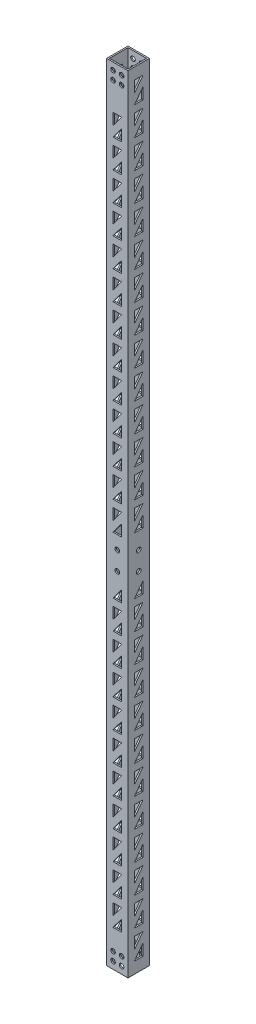
from build123d import *

# Parameters (mm, degrees)
SKETCH_1_W          = 15
SKETCH_1_H          = 15
SKETCH_1_W_2        = 13
SKETCH_1_H_2        = 13
EXTRUDE_1_DEPTH     = 551
SKETCH_2_R          = 1.6
CUT_EXTRUDE_1_DEPTH = 15
SKETCH_4_R          = 1.6
CUT_EXTRUDE_2_DEPTH = 15


with BuildPart() as part:
    # 草图1 → 凸台-拉伸1 (new body)
    with BuildSketch(Plane(origin=(0, 0, 0), x_dir=(1, 0, 0), z_dir=(0, 1, 0))):
        Rectangle(SKETCH_1_W, SKETCH_1_H)
        Rectangle(SKETCH_1_W_2, SKETCH_1_H_2, mode=Mode.SUBTRACT)
    extrude(amount=EXTRUDE_1_DEPTH)

    # 草图2 → 切除-拉伸1 (cut)
    with BuildSketch(Plane.XY.offset(7.5)):
        with Locations((-3, 546)):
            Circle(SKETCH_2_R)
        with Locations((3, 546)):
            Circle(SKETCH_2_R)
        with Locations((-3, 540)):
            Circle(SKETCH_2_R)
        with Locations((3, 540)):
            Circle(SKETCH_2_R)
        with Locations((3, 11)):
            Circle(SKETCH_2_R)
        with Locations((-3, 11)):
            Circle(SKETCH_2_R)
        with Locations((3, 5)):
            Circle(SKETCH_2_R)
        with Locations((-3, 5)):
            Circle(SKETCH_2_R)
        with Locations((0, 256.2)):
            Circle(SKETCH_2_R)
        with Locations((0, 243.2)):
            Circle(SKETCH_2_R)
        Polygon((-3, 512.5), (-3, 520.5), (3, 520.5), align=None)
        Polygon((-3, 505.5), (3, 505.5), (3, 513.5), align=None)
        Polygon((3, 500.5), (-3, 492.5), (-3, 500.5), align=None)
        Polygon((3, 493.5), (-3, 485.5), (3, 485.5), align=None)
        Polygon((3, 480.5), (-3, 472.5), (-3, 480.5), align=None)
        Polygon((3, 473.5), (-3, 465.5), (3, 465.5), align=None)
        Polygon((3, 460.5), (-3, 452.5), (-3, 460.5), align=None)
        Polygon((3, 453.5), (-3, 445.5), (3, 445.5), align=None)
        Polygon((3, 440.5), (-3, 432.5), (-3, 440.5), align=None)
        Polygon((3, 433.5), (-3, 425.5), (3, 425.5), align=None)
        Polygon((3, 420.5), (-3, 412.5), (-3, 420.5), align=None)
        Polygon((3, 413.5), (-3, 405.5), (3, 405.5), align=None)
        Polygon((3, 400.5), (-3, 392.5), (-3, 400.5), align=None)
        Polygon((3, 393.5), (-3, 385.5), (3, 385.5), align=None)
        Polygon((3, 380.5), (-3, 372.5), (-3, 380.5), align=None)
        Polygon((3, 373.5), (-3, 365.5), (3, 365.5), align=None)
        Polygon((3, 360.5), (-3, 352.5), (-3, 360.5), align=None)
        Polygon((3, 353.5), (-3, 345.5), (3, 345.5), align=None)
        Polygon((3, 340.5), (-3, 332.5), (-3, 340.5), align=None)
        Polygon((3, 333.5), (-3, 325.5), (3, 325.5), align=None)
        Polygon((3, 320.5), (-3, 312.5), (-3, 320.5), align=None)
        Polygon((3, 313.5), (-3, 305.5), (3, 305.5), align=None)
        Polygon((3, 300.5), (-3, 292.5), (-3, 300.5), align=None)
        Polygon((3, 293.5), (-3, 285.5), (3, 285.5), align=None)
        Polygon((3, 280.5), (-3, 272.5), (-3, 280.5), align=None)
        Polygon((3, 273.5), (-3, 265.5), (3, 265.5), align=None)
        Polygon((3, 233.5), (-3, 225.5), (3, 225.5), align=None)
        Polygon((3, 220.5), (-3, 212.5), (-3, 220.5), align=None)
        Polygon((3, 213.5), (-3, 205.5), (3, 205.5), align=None)
        Polygon((3, 200.5), (-3, 192.5), (-3, 200.5), align=None)
        Polygon((3, 193.5), (-3, 185.5), (3, 185.5), align=None)
        Polygon((3, 180.5), (-3, 172.5), (-3, 180.5), align=None)
        Polygon((3, 173.5), (-3, 165.5), (3, 165.5), align=None)
        Polygon((3, 160.5), (-3, 152.5), (-3, 160.5), align=None)
        Polygon((3, 153.5), (-3, 145.5), (3, 145.5), align=None)
        Polygon((3, 140.5), (-3, 132.5), (-3, 140.5), align=None)
        Polygon((3, 133.5), (-3, 125.5), (3, 125.5), align=None)
        Polygon((3, 120.5), (-3, 112.5), (-3, 120.5), align=None)
        Polygon((3, 113.5), (-3, 105.5), (3, 105.5), align=None)
        Polygon((3, 100.5), (-3, 92.5), (-3, 100.5), align=None)
        Polygon((3, 93.5), (-3, 85.5), (3, 85.5), align=None)
        Polygon((3, 80.5), (-3, 72.5), (-3, 80.5), align=None)
        Polygon((3, 73.5), (-3, 65.5), (3, 65.5), align=None)
        Polygon((3, 60.5), (-3, 52.5), (-3, 60.5), align=None)
        Polygon((3, 53.5), (-3, 45.5), (3, 45.5), align=None)
        Polygon((3, 40.5), (-3, 32.5), (-3, 40.5), align=None)
        Polygon((3, 33.5), (-3, 25.5), (3, 25.5), align=None)
    extrude(amount=-CUT_EXTRUDE_1_DEPTH, mode=Mode.SUBTRACT)

    # 草图4 → 切除-拉伸2 (cut)
    with BuildSketch(Plane(origin=(7.5, 0, 0), x_dir=(0, 0, -1), z_dir=(1, 0, 0))):
        with Locations((0, 256.2)):
            Circle(SKETCH_4_R)
        with Locations((0, 243.2)):
            Circle(SKETCH_4_R)
        Polygon((-3, 543), (3, 543), (-3, 535), align=None)
        Polygon((-3, 528), (3, 536), (3, 528), align=None)
        Polygon((-3, 515), (-3, 523), (3, 523), align=None)
        Polygon((3, 508), (-3, 508), (3, 516), align=None)
        Polygon((-3, 495), (-3, 503), (3, 503), align=None)
        Polygon((3, 488), (-3, 488), (3, 496), align=None)
        Polygon((-3, 475), (-3, 483), (3, 483), align=None)
        Polygon((3, 468), (-3, 468), (3, 476), align=None)
        Polygon((-3, 455), (-3, 463), (3, 463), align=None)
        Polygon((3, 448), (-3, 448), (3, 456), align=None)
        Polygon((-3, 435), (-3, 443), (3, 443), align=None)
        Polygon((3, 428), (-3, 428), (3, 436), align=None)
        Polygon((-3, 415), (-3, 423), (3, 423), align=None)
        Polygon((3, 408), (-3, 408), (3, 416), align=None)
        Polygon((-3, 395), (-3, 403), (3, 403), align=None)
        Polygon((3, 388), (-3, 388), (3, 396), align=None)
        Polygon((-3, 375), (-3, 383), (3, 383), align=None)
        Polygon((3, 368), (-3, 368), (3, 376), align=None)
        Polygon((-3, 355), (-3, 363), (3, 363), align=None)
        Polygon((3, 348), (-3, 348), (3, 356), align=None)
        Polygon((-3, 335), (-3, 343), (3, 343), align=None)
        Polygon((3, 328), (-3, 328), (3, 336), align=None)
        Polygon((-3, 315), (-3, 323), (3, 323), align=None)
        Polygon((3, 308), (-3, 308), (3, 316), align=None)
        Polygon((-3, 295), (-3, 303), (3, 303), align=None)
        Polygon((3, 288), (-3, 288), (3, 296), align=None)
        Polygon((-3, 275), (-3, 283), (3, 283), align=None)
        Polygon((3, 268), (-3, 268), (3, 276), align=None)
        Polygon((3, 228), (-3, 228), (3, 236), align=None)
        Polygon((-3, 215), (-3, 223), (3, 223), align=None)
        Polygon((3, 208), (-3, 208), (3, 216), align=None)
        Polygon((-3, 195), (-3, 203), (3, 203), align=None)
        Polygon((3, 188), (-3, 188), (3, 196), align=None)
        Polygon((-3, 175), (-3, 183), (3, 183), align=None)
        Polygon((3, 168), (-3, 168), (3, 176), align=None)
        Polygon((-3, 155), (-3, 163), (3, 163), align=None)
        Polygon((3, 148), (-3, 148), (3, 156), align=None)
        Polygon((-3, 135), (-3, 143), (3, 143), align=None)
        Polygon((3, 128), (-3, 128), (3, 136), align=None)
        Polygon((-3, 115), (-3, 123), (3, 123), align=None)
        Polygon((3, 108), (-3, 108), (3, 116), align=None)
        Polygon((-3, 95), (-3, 103), (3, 103), align=None)
        Polygon((3, 88), (-3, 88), (3, 96), align=None)
        Polygon((-3, 75), (-3, 83), (3, 83), align=None)
        Polygon((3, 68), (-3, 68), (3, 76), align=None)
        Polygon((-3, 55), (-3, 63), (3, 63), align=None)
        Polygon((3, 48), (-3, 48), (3, 56), align=None)
        Polygon((-3, 35), (-3, 43), (3, 43), align=None)
        Polygon((3, 28), (-3, 28), (3, 36), align=None)
        Polygon((-3, 15), (-3, 23), (3, 23), align=None)
        Polygon((3, 8), (-3, 8), (3, 16), align=None)
    extrude(amount=-CUT_EXTRUDE_2_DEPTH, mode=Mode.SUBTRACT)


solid = part.part
